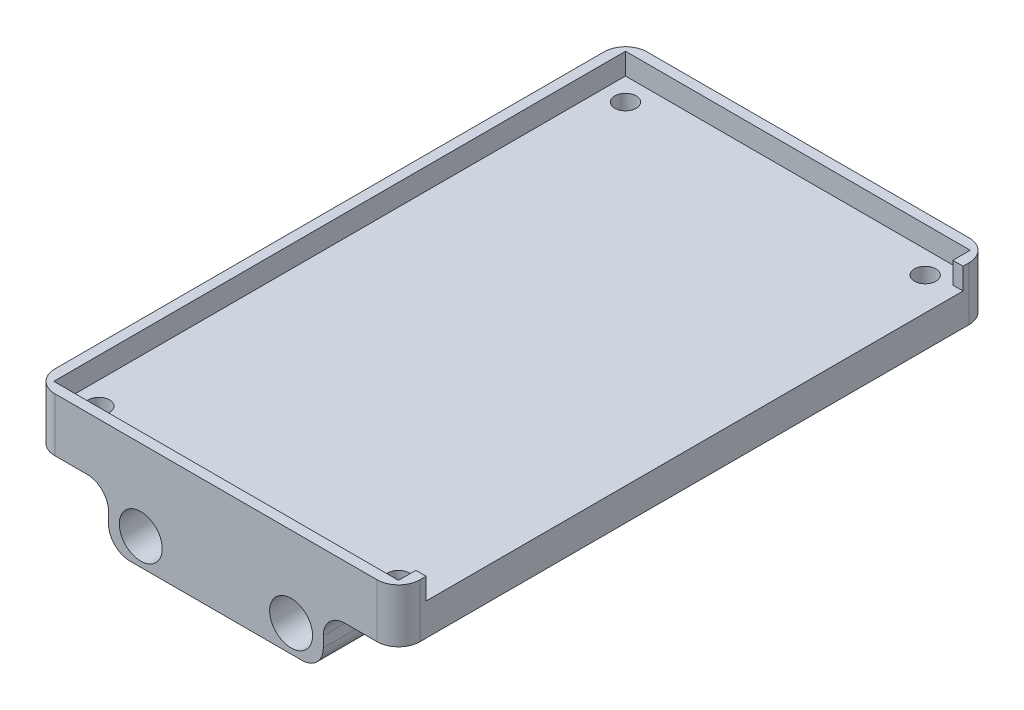
from build123d import *

# Parameters (mm, degrees)
SKETCH_1_W          = 34
SKETCH_1_H          = 55.14
EXTRUDE_1_DEPTH     = 5
SKETCH_2_W          = 32.1
SKETCH_2_H          = 53.24
CUT_EXTRUDE_1_DEPTH = 2
SKETCH_3_W          = 50
SKETCH_3_H          = 10
CUT_EXTRUDE_2_DEPTH = 2
FILLET_3_R          = 2
FILLET_4_R          = 2
FILLET_5_R          = 2
FILLET_6_R          = 2
SKETCH_5_R          = 1
CUT_EXTRUDE_3_DEPTH = 5
CUT_EXTRUDE_5_DEPTH = 5
SKETCH_7_W          = 24.577640881
SKETCH_7_H          = 46.089683544
EXTRUDE_3_DEPTH     = 3
SKETCH_8_W          = 20
SKETCH_8_H          = 6
EXTRUDE_5_DEPTH     = 5
SKETCH_9_W          = 20
SKETCH_9_H          = 6
EXTRUDE_6_DEPTH     = 5
CUT_EXTRUDE_6_DEPTH = 65.972452624
FILLET_7_R          = 2
FILLET_8_R          = 2
FILLET_9_R          = 2
FILLET_10_R         = 2
FILLET_11_R         = 2
FILLET_12_R         = 2
FILLET_13_R         = 2
FILLET_14_R         = 2
SKETCH_11_W         = 2
SKETCH_11_H         = 50
EXTRUDE_7_DEPTH     = 3


with BuildPart() as part:
    # 草图1 → 凸台-拉伸1 (new body)
    with BuildSketch(Plane(origin=(0, 0, 0), x_dir=(1, 0, 0), z_dir=(0, 1, 0))):
        with Locations((17, 27.57)):
            Rectangle(SKETCH_1_W, SKETCH_1_H)
    extrude(amount=EXTRUDE_1_DEPTH)

    # 草图2 → 切除-拉伸1 (cut)
    with BuildSketch(Plane(origin=(0, 5, 0), x_dir=(1, 0, 0), z_dir=(0, 1, 0))):
        with Locations((17, 27.57)):
            Rectangle(SKETCH_2_W, SKETCH_2_H)
    extrude(amount=-CUT_EXTRUDE_1_DEPTH, mode=Mode.SUBTRACT)

    # 草图3 → 切除-拉伸2 (cut)
    with BuildSketch(Plane(origin=(34, 0, 0), x_dir=(0, 0, -1), z_dir=(1, 0, 0))):
        with Locations((27.57, 5)):
            Rectangle(SKETCH_3_W, SKETCH_3_H)
    extrude(amount=-CUT_EXTRUDE_2_DEPTH, mode=Mode.SUBTRACT)

    # 圆角3
    fillet_3_edges = [part.edges().sort_by_distance(p)[0] for p in [
        (0, 2.5, 0),
    ]]
    fillet(fillet_3_edges, radius=FILLET_3_R)

    # 圆角4
    fillet_4_edges = [part.edges().sort_by_distance(p)[0] for p in [
        (0, 2.5, -55.14),
    ]]
    fillet(fillet_4_edges, radius=FILLET_4_R)

    # 圆角5
    fillet_5_edges = [part.edges().sort_by_distance(p)[0] for p in [
        (34, 2.5, -55.14),
    ]]
    fillet(fillet_5_edges, radius=FILLET_5_R)

    # 圆角6
    fillet_6_edges = [part.edges().sort_by_distance(p)[0] for p in [
        (34, 2.5, 0),
    ]]
    fillet(fillet_6_edges, radius=FILLET_6_R)

    # 草图5 → 切除-拉伸3 (cut)
    with BuildSketch(Plane(origin=(0, 3, 0), x_dir=(1, 0, 0), z_dir=(0, 1, 0))):
        with Locations(Location((3.05, 52.09, 0), (0, 0, 270))):
            Circle(SKETCH_5_R)
        with Locations(Location((3.05, 3.05, 0), (0, 0, 90))):
            Circle(SKETCH_5_R)
        with Locations(Location((30.95, 3.05, 0), (0, 0, 270))):
            Circle(SKETCH_5_R)
        with Locations(Location((30.95, 52.09, 0), (0, 0, 90))):
            Circle(SKETCH_5_R)
    extrude(amount=-CUT_EXTRUDE_3_DEPTH, mode=Mode.SUBTRACT)

    # 草图6 → 切除-拉伸5 (cut)
    with BuildSketch(Plane(origin=(0, 3, 0), x_dir=(1, 0, 0), z_dir=(0, 1, 0))):
        with BuildLine():
            ThreePointArc((5.05, 49.09), (5.342893219, 49.797106781), (6.05, 50.09))
            Line((6.05, 50.09), (6.254717451, 50.09))
            ThreePointArc((6.254717451, 50.09), (6.961824232, 49.797106781), (7.254717451, 49.09))
            Line((7.254717451, 49.09), (7.254717451, 6.05))
            ThreePointArc((7.254717451, 6.05), (6.961824232, 5.342893219), (6.254717451, 5.05))
            Line((6.254717451, 5.05), (6.05, 5.05))
            ThreePointArc((6.05, 5.05), (5.342893219, 5.342893219), (5.05, 6.05))
            Line((5.05, 6.05), (5.05, 49.09))
        make_face()
        with BuildLine():
            ThreePointArc((10.05, 49.09), (10.342893219, 49.797106781), (11.05, 50.09))
            Line((11.05, 50.09), (11.254717451, 50.09))
            ThreePointArc((11.254717451, 50.09), (11.961824232, 49.797106781), (12.254717451, 49.09))
            Line((12.254717451, 49.09), (12.254717451, 6.05))
            ThreePointArc((12.254717451, 6.05), (11.961824232, 5.342893219), (11.254717451, 5.05))
            Line((11.254717451, 5.05), (11.05, 5.05))
            ThreePointArc((11.05, 5.05), (10.342893219, 5.342893219), (10.05, 6.05))
            Line((10.05, 6.05), (10.05, 49.09))
        make_face()
        with BuildLine():
            ThreePointArc((20.05, 49.09), (20.342893219, 49.797106781), (21.05, 50.09))
            Line((21.05, 50.09), (21.254717451, 50.09))
            ThreePointArc((21.254717451, 50.09), (21.961824232, 49.797106781), (22.254717451, 49.09))
            Line((22.254717451, 49.09), (22.254717451, 6.05))
            ThreePointArc((22.254717451, 6.05), (21.961824232, 5.342893219), (21.254717451, 5.05))
            Line((21.254717451, 5.05), (21.05, 5.05))
            ThreePointArc((21.05, 5.05), (20.342893219, 5.342893219), (20.05, 6.05))
            Line((20.05, 6.05), (20.05, 49.09))
        make_face()
        with BuildLine():
            ThreePointArc((26.05, 5.05), (25.342893219, 5.342893219), (25.05, 6.05))
            Line((25.05, 6.05), (25.05, 49.09))
            ThreePointArc((25.05, 49.09), (25.342893219, 49.797106781), (26.05, 50.09))
            Line((26.05, 50.09), (26.254717451, 50.09))
            ThreePointArc((26.254717451, 50.09), (26.961824232, 49.797106781), (27.254717451, 49.09))
            Line((27.254717451, 49.09), (27.254717451, 6.05))
            ThreePointArc((27.254717451, 6.05), (26.961824232, 5.342893219), (26.254717451, 5.05))
            Line((26.254717451, 5.05), (26.05, 5.05))
        make_face()
        with BuildLine():
            Line((15.05, 49.09), (15.05, 6.05))
            ThreePointArc((15.05, 6.05), (15.342893219, 5.342893219), (16.05, 5.05))
            Line((16.05, 5.05), (16.254717451, 5.05))
            ThreePointArc((16.254717451, 5.05), (16.961824232, 5.342893219), (17.254717451, 6.05))
            Line((17.254717451, 6.05), (17.254717451, 49.09))
            ThreePointArc((17.254717451, 49.09), (16.961824232, 49.797106781), (16.254717451, 50.09))
            Line((16.254717451, 50.09), (16.05, 50.09))
            ThreePointArc((16.05, 50.09), (15.342893219, 49.797106781), (15.05, 49.09))
        make_face()
    extrude(amount=-CUT_EXTRUDE_5_DEPTH, mode=Mode.SUBTRACT)

    # 草图7 → 凸台-拉伸3 (add)
    with BuildSketch(Plane.XZ):
        with Locations((15.625766317, -27.57)):
            Rectangle(SKETCH_7_W, SKETCH_7_H)
    extrude(amount=-EXTRUDE_3_DEPTH)

    # 草图8 → 凸台-拉伸5 (add)
    with BuildSketch(Plane.XZ):
        with Locations((17, -3)):
            Rectangle(SKETCH_8_W, SKETCH_8_H)
    extrude(amount=EXTRUDE_5_DEPTH)

    # 草图9 → 凸台-拉伸6 (add)
    with BuildSketch(Plane.XZ):
        with Locations((17, -52.14)):
            Rectangle(SKETCH_9_W, SKETCH_9_H)
    extrude(amount=EXTRUDE_6_DEPTH)

    # 草图10 → 切除-拉伸6 (cut, through all)
    with BuildSketch(Plane(origin=(0, 0, -55.14), x_dir=(-1, 0, 0), z_dir=(0, 0, -1))):
        with BuildLine():
            ThreePointArc((-8, -2.5), (-11.414213562, -1.085786438), (-10, -4.5))
            Line((-10, -4.5), (-10, -2.5))
            Line((-10, -2.5), (-8, -2.5))
        make_face()
        with BuildLine():
            Line((-10, -2.5), (-10, -4.5))
            ThreePointArc((-10, -4.5), (-8.585786438, -3.914213562), (-8, -2.5))
            Line((-8, -2.5), (-10, -2.5))
        make_face()
        with BuildLine():
            ThreePointArc((-26, -2.5), (-25.414213562, -3.914213562), (-24, -4.5))
            Line((-24, -4.5), (-24, -2.5))
            Line((-24, -2.5), (-26, -2.5))
        make_face()
        with BuildLine():
            Line((-24, -2.5), (-24, -4.5))
            ThreePointArc((-24, -4.5), (-22.585786438, -3.914213562), (-22, -2.5))
            ThreePointArc((-22, -2.5), (-24, -0.5), (-26, -2.5))
            Line((-26, -2.5), (-24, -2.5))
        make_face()
    extrude(amount=-CUT_EXTRUDE_6_DEPTH, mode=Mode.SUBTRACT)

    # 圆角7
    fillet_7_edges = [part.edges().sort_by_distance(p)[0] for p in [
        (7, -5, -52.14),
    ]]
    fillet(fillet_7_edges, radius=FILLET_7_R)

    # 圆角8
    fillet_8_edges = [part.edges().sort_by_distance(p)[0] for p in [
        (7, 0, -52.14),
    ]]
    fillet(fillet_8_edges, radius=FILLET_8_R)

    # 圆角9
    fillet_9_edges = [part.edges().sort_by_distance(p)[0] for p in [
        (27, -5, -52.14),
    ]]
    fillet(fillet_9_edges, radius=FILLET_9_R)

    # 圆角10
    fillet_10_edges = [part.edges().sort_by_distance(p)[0] for p in [
        (27, 0, -52.14),
    ]]
    fillet(fillet_10_edges, radius=FILLET_10_R)

    # 圆角11
    fillet_11_edges = [part.edges().sort_by_distance(p)[0] for p in [
        (7, -5, -3),
    ]]
    fillet(fillet_11_edges, radius=FILLET_11_R)

    # 圆角12
    fillet_12_edges = [part.edges().sort_by_distance(p)[0] for p in [
        (7, 0, -3),
    ]]
    fillet(fillet_12_edges, radius=FILLET_12_R)

    # 圆角13
    fillet_13_edges = [part.edges().sort_by_distance(p)[0] for p in [
        (27, -5, -3),
    ]]
    fillet(fillet_13_edges, radius=FILLET_13_R)

    # 圆角14
    fillet_14_edges = [part.edges().sort_by_distance(p)[0] for p in [
        (27, 0, -3),
    ]]
    fillet(fillet_14_edges, radius=FILLET_14_R)

    # 草图11 → 凸台-拉伸7 (add)
    with BuildSketch(Plane.XZ):
        with Locations((33, -27.57)):
            Rectangle(SKETCH_11_W, SKETCH_11_H)
    extrude(amount=-EXTRUDE_7_DEPTH)


solid = part.part
